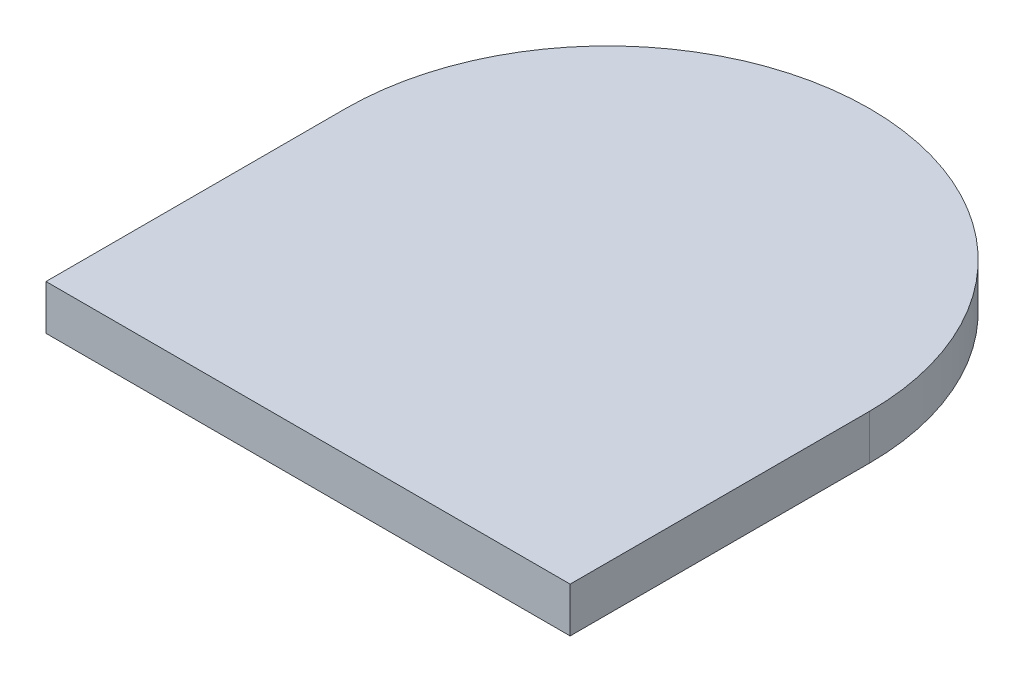
from build123d import *

# Parameters (mm, degrees)
EXTRUDE_1_DEPTH = 3


with BuildPart() as part:
    # 草图1 → 凸台-拉伸1 (new body)
    with BuildSketch(Plane(origin=(0, 0, 0), x_dir=(1, 0, 0), z_dir=(0, 1, 0))):
        with BuildLine():
            Line((-17.5, 0), (-17.5, -20))
            Line((-17.5, -20), (17.5, -20))
            Line((17.5, -20), (17.5, 0))
            ThreePointArc((17.5, 0), (0, 17.5), (-17.5, 0))
        make_face()
    extrude(amount=EXTRUDE_1_DEPTH)


solid = part.part
